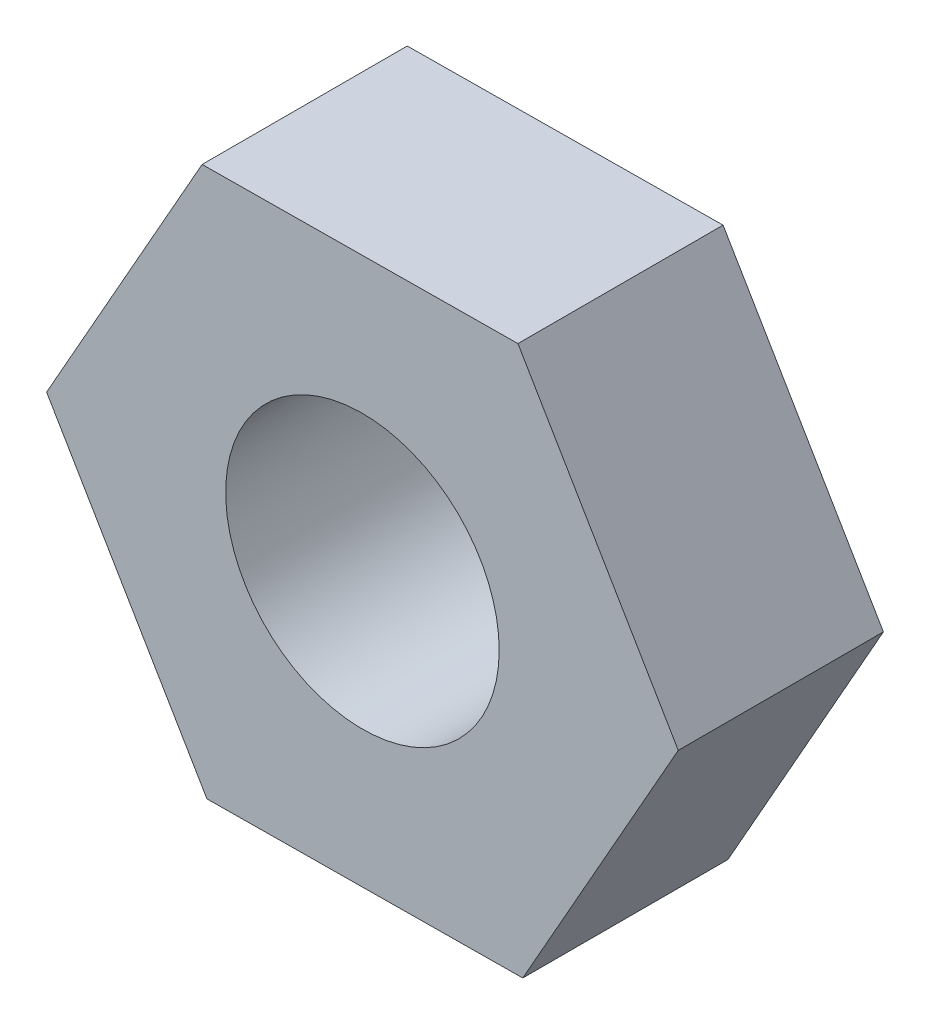
from build123d import *

# Parameters (mm, degrees)
SKETCH_1_R      = 1
EXTRUDE_1_DEPTH = 1.5


with BuildPart() as part:
    # 草图1 → 凸台-拉伸1 (new body)
    with BuildSketch(Plane.XY):
        Polygon((1.172260713, -1.989758315), (2.309311605, 0.0203284), (1.137050892, 2.010086715), (-1.172260713, 1.989758315), (-2.309311605, -0.0203284), (-1.137050892, -2.010086715), align=None)
        Circle(SKETCH_1_R, mode=Mode.SUBTRACT)
    extrude(amount=EXTRUDE_1_DEPTH)


solid = part.part
